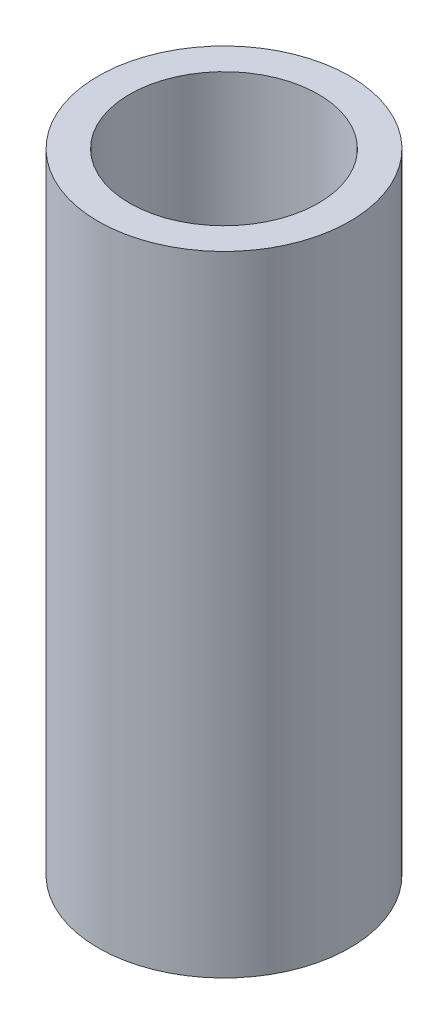
from build123d import *

# Parameters (mm, degrees)
SKETCH1_R           = 10.16
SKETCH1_R_2         = 7.62
BOSS_EXTRUDE1_DEPTH = 50.8


with BuildPart() as part:
    # Sketch1 → Boss-Extrude1 (new body)
    with BuildSketch(Plane(origin=(0, 0, 0), x_dir=(1, 0, 0), z_dir=(0, 1, 0))):
        with Locations(Location((0, 0, 0), (0, 0, 270))):
            Circle(SKETCH1_R)
        with Locations(Location((0, 0, 0), (0, 0, 270))):
            Circle(SKETCH1_R_2, mode=Mode.SUBTRACT)
    extrude(amount=BOSS_EXTRUDE1_DEPTH)


solid = part.part
